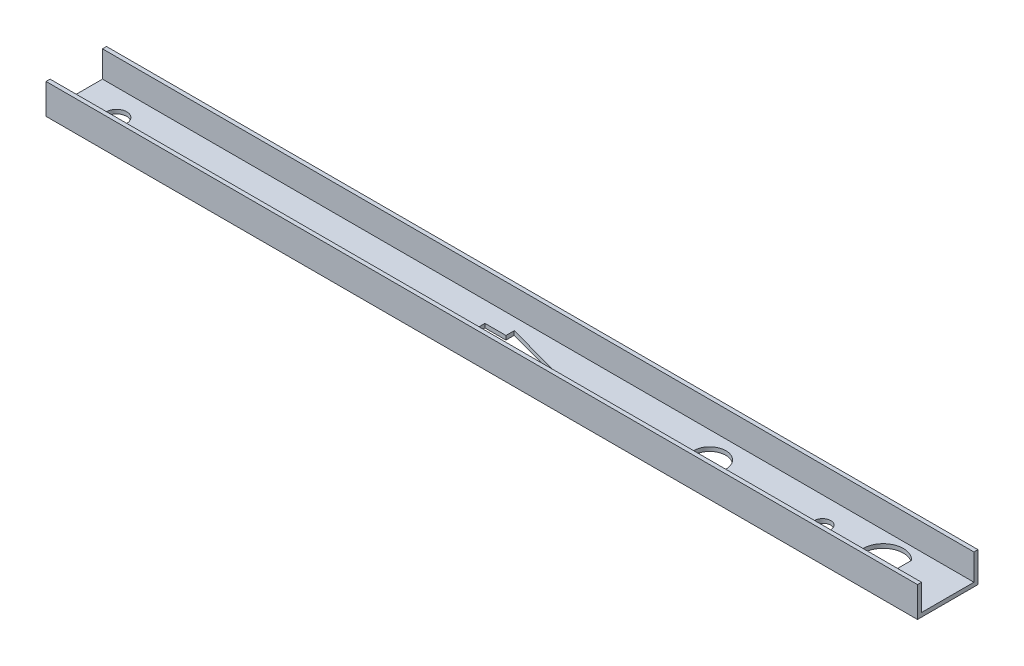
from build123d import *

# Parameters (mm, degrees)
BOSS_EXTRU_1_DEPTH      = 108
ESQUISSE2_R             = 2.5
ESQUISSE2_R_2           = 4
ESQUISSE2_R_3           = 2
ENL_V_MAT_EXTRU_1_DEPTH = 109.455059817


with BuildPart() as part:
    # Esquisse1 → Boss.-Extru.1 (new, symmetric)
    with BuildSketch(Plane(origin=(0, 0, 0), x_dir=(0, 0, -1), z_dir=(1, 0, 0))):
        Polygon((-7.5, 6.5), (-7.5, -1), (7.5, -1), (7.5, 6.5), (6.5, 6.5), (6.5, 0), (-6.5, 0), (-6.5, 6.5), align=None)
    extrude(amount=BOSS_EXTRU_1_DEPTH, both=True)

    # Esquisse2 → Enlèv. mat.-Extru.1 (cut, through all)
    with BuildSketch(Plane(origin=(0, 0, 0), x_dir=(1, 0, 0), z_dir=(0, 1, 0))):
        with Locations(Location((-98, 0, 0), (0, 0, 270))):
            Circle(ESQUISSE2_R)
        with Locations(Location((49, 0, 0), (0, 0, 270))):
            Circle(ESQUISSE2_R_2)
        with Locations(Location((77, 0, 0), (0, 0, 270))):
            Circle(ESQUISSE2_R_3)
        with BuildLine():
            Line((95.570714214, 3.5), (95.570714214, -3.5))
            ThreePointArc((95.570714214, -3.5), (87, 0), (95.570714214, 3.5))
        make_face()
        Polygon((-8.175932032, 1.473487567), (-8.175932032, -1.501256313), (-2.970130241, -1.501256313), (-2.970130241, -3.267510492), (10.137334983, 0), (-2.970130241, 3.518623985), (-2.970130241, 1.473487567), align=None)
    extrude(amount=-ENL_V_MAT_EXTRU_1_DEPTH, mode=Mode.SUBTRACT)


solid = part.part
